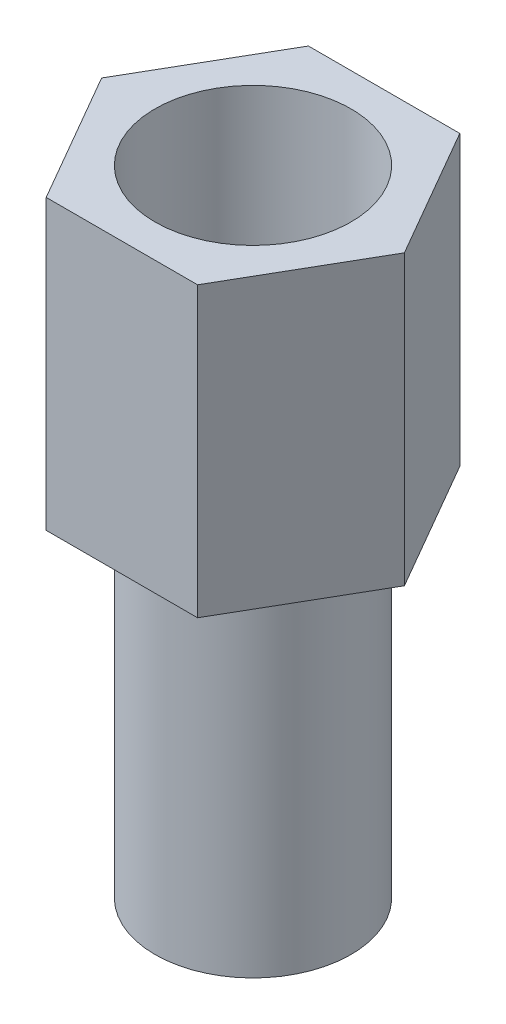
from build123d import *

# Parameters (mm, degrees)
EXTRUDE_1_DEPTH     = 5
SKETCH_2_R          = 1.7
EXTRUDE_2_DEPTH     = 6
SKETCH_3_R          = 1.7
CUT_EXTRUDE_1_DEPTH = 4


with BuildPart() as part:
    # 草图1 → 凸台-拉伸1 (new body)
    with BuildSketch(Plane(origin=(0, 0, 0), x_dir=(1, 0, 0), z_dir=(0, 1, 0))):
        Polygon((1.3125, -2.273316685), (2.625, 0), (1.3125, 2.273316685), (-1.3125, 2.273316685), (-2.625, 0), (-1.3125, -2.273316685), align=None)
    extrude(amount=EXTRUDE_1_DEPTH)

    # 草图2 → 凸台-拉伸2 (add)
    with BuildSketch(Plane(origin=(0, 0, 0), x_dir=(1, 0, 0), z_dir=(0, 1, 0))):
        with Locations(Location((0, 0, 0), (0, 0, 270))):
            Circle(SKETCH_2_R)
    extrude(amount=-EXTRUDE_2_DEPTH)

    # 草图3 → 切除-拉伸1 (cut)
    with BuildSketch(Plane(origin=(0, 5, 0), x_dir=(1, 0, 0), z_dir=(0, 1, 0))):
        with Locations(Location((0, 0, 0), (0, 0, 270))):
            Circle(SKETCH_3_R)
    extrude(amount=-CUT_EXTRUDE_1_DEPTH, mode=Mode.SUBTRACT)


solid = part.part
